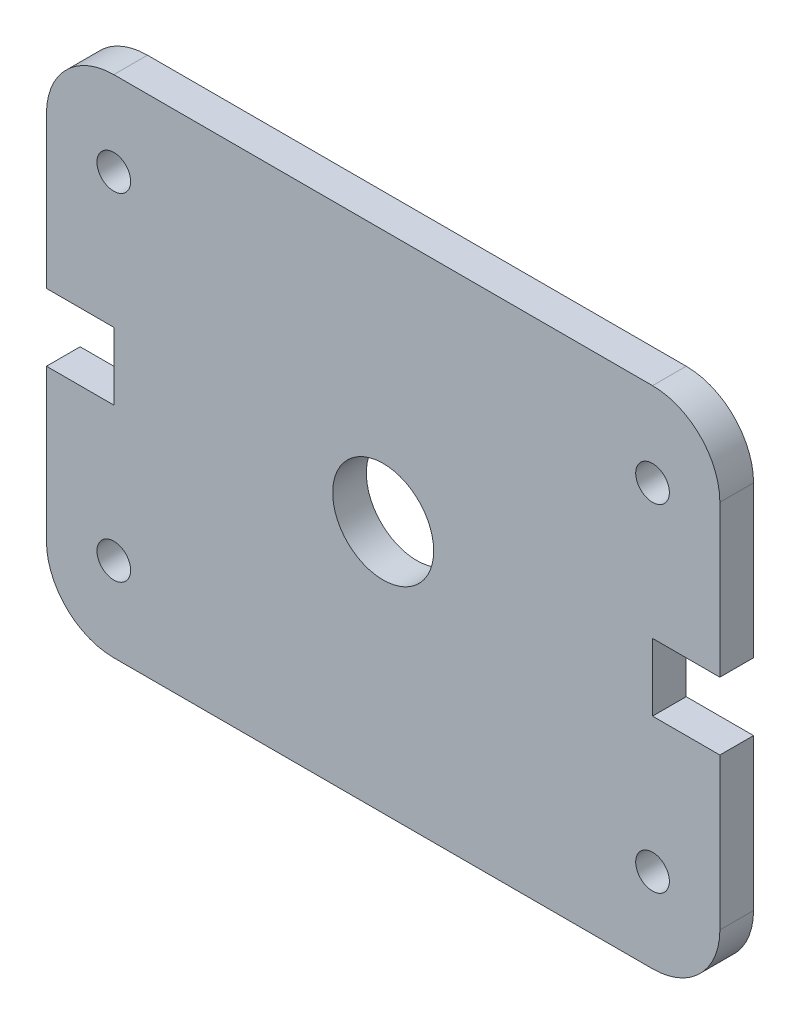
from build123d import *

# Parameters (mm, degrees)
BOSS_EXTRUDE1_DEPTH = 2.5
SKETCH2_R           = 2.5
SKETCH2_R_2         = 7.5
CUT_EXTRUDE1_DEPTH  = 63.69968102
SKETCH4_W           = 10
SKETCH4_H           = 10
CUT_EXTRUDE3_DEPTH  = 10


with BuildPart() as part:
    # Sketch1 → Boss-Extrude1 (new, symmetric)
    with BuildSketch(Plane.XY):
        with BuildLine():
            Line((-40, -37.5), (40, -37.5))
            ThreePointArc((40, -37.5), (47.071067812, -34.571067812), (50, -27.5))
            Line((50, -27.5), (50, 27.5))
            ThreePointArc((50, 27.5), (47.071067812, 34.571067812), (40, 37.5))
            Line((40, 37.5), (-40, 37.5))
            ThreePointArc((-40, 37.5), (-47.071067812, 34.571067812), (-50, 27.5))
            Line((-50, 27.5), (-50, -27.5))
            ThreePointArc((-50, -27.5), (-47.071067812, -34.571067812), (-40, -37.5))
        make_face()
    extrude(amount=BOSS_EXTRUDE1_DEPTH, both=True)

    # Sketch2 → Cut-Extrude1 (cut, through all)
    with BuildSketch(Plane.XY.offset(2.5)):
        with Locations((40, 25)):
            Circle(SKETCH2_R)
        with Locations((-40, 25)):
            Circle(SKETCH2_R)
        with Locations((-40, -25)):
            Circle(SKETCH2_R)
        with Locations((40, -25)):
            Circle(SKETCH2_R)
        Circle(SKETCH2_R_2)
    extrude(amount=-CUT_EXTRUDE1_DEPTH, mode=Mode.SUBTRACT)

    # Sketch4 → Cut-Extrude3 (cut)
    with BuildSketch(Plane(origin=(0, 0, -2.5), x_dir=(-1, 0, 0), z_dir=(0, 0, -1))):
        with Locations((45, 0)):
            Rectangle(SKETCH4_W, SKETCH4_H)
        with Locations((-45, 0)):
            Rectangle(SKETCH4_W, SKETCH4_H)
    extrude(amount=-CUT_EXTRUDE3_DEPTH, mode=Mode.SUBTRACT)


solid = part.part
